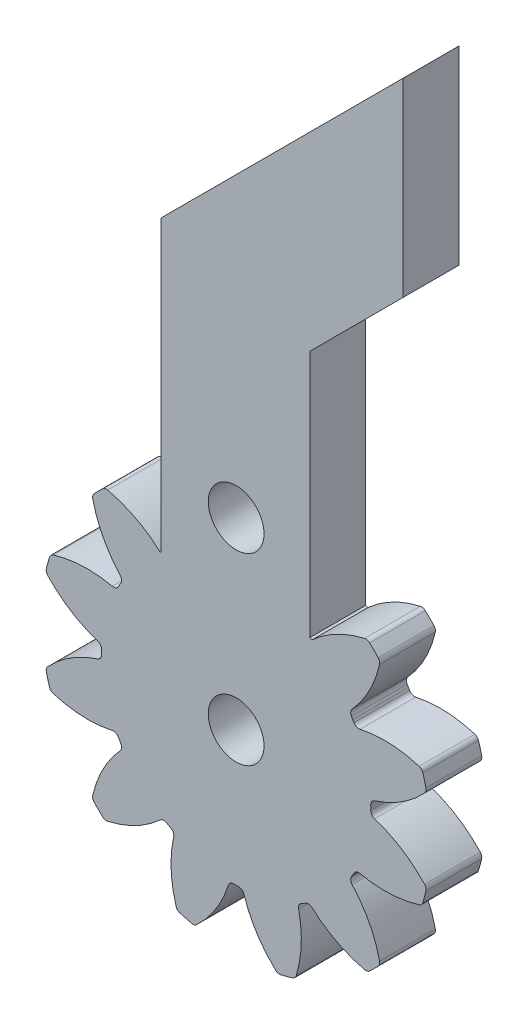
from build123d import *

# Parameters (mm, degrees)
ESQUISSE18_R        = 1.5
BOSS_EXTRU_18_DEPTH = 3


with BuildPart() as part:
    # Esquisse18 → Boss.-Extru.18 (new body)
    with BuildSketch(Plane.XY):
        with BuildLine():
            Line((83.995271076, 16.559954608), (97.025632531, 29.590316063))
            Line((97.025632531, 29.590316063), (97.025632531, 19.364814746))
            Line((97.025632531, 19.364814746), (91.995271076, 14.334453291))
            Line((91.995271076, 14.334453291), (91.995271076, 0.979857371))
            Line((91.995271076, 0.979857371), (92.123404239, 0.943388643))
            ThreePointArc((92.123404239, 0.943388643), (93.440738996, 1.864842376), (94.949542599, 2.419783395))
            ThreePointArc((94.949542599, 2.419783395), (95.094740148, 2.416733928), (95.221491727, 2.345842004))
            ThreePointArc((95.221491727, 2.345842004), (95.454932198, 2.119520802), (95.6812534, 1.886080331))
            ThreePointArc((95.6812534, 1.886080331), (95.752145324, 1.759328753), (95.755194791, 1.614131203))
            ThreePointArc((95.755194791, 1.614131203), (95.200253772, 0.1053276), (94.278800038, -1.212007157))
            ThreePointArc((94.278800038, -1.212007157), (94.201940613, -1.384508915), (94.243380312, -1.568755975))
            Line((94.243380312, -1.568755975), (94.308995173, -1.680100401))
            ThreePointArc((94.308995173, -1.680100401), (94.341055685, -1.73620681), (94.372614843, -1.792596749))
            ThreePointArc((94.372614843, -1.792596749), (94.511457628, -1.920608112), (94.699278246, -1.940296776))
            ThreePointArc((94.699278246, -1.940296776), (96.300850478, -1.800961813), (97.884983236, -2.074770594))
            ThreePointArc((97.884983236, -2.074770594), (98.009203269, -2.150010285), (98.083527395, -2.274780281))
            ThreePointArc((98.083527395, -2.274780281), (98.172532171, -2.587500427), (98.251811846, -2.902826406))
            ThreePointArc((98.251811846, -2.902826406), (98.249830264, -3.048042455), (98.179872405, -3.175311955))
            ThreePointArc((98.179872405, -3.175311955), (96.944877584, -4.204503695), (95.488207864, -4.884622193))
            ThreePointArc((95.488207864, -4.884622193), (95.33539477, -4.995583385), (95.279159072, -5.175865869))
            Line((95.279159072, -5.175865869), (95.280310995, -5.305100401))
            ThreePointArc((95.280310995, -5.305100401), (95.280023009, -5.369720233), (95.279159072, -5.434334932))
            ThreePointArc((95.279159072, -5.434334932), (95.33539477, -5.614617416), (95.488207864, -5.725578608))
            ThreePointArc((95.488207864, -5.725578608), (96.944877584, -6.405697106), (98.179872405, -7.434888846))
            ThreePointArc((98.179872405, -7.434888846), (98.249830264, -7.562158346), (98.251811846, -7.707374395))
            ThreePointArc((98.251811846, -7.707374395), (98.172532171, -8.022700374), (98.083527395, -8.33542052))
            ThreePointArc((98.083527395, -8.33542052), (98.009203269, -8.460190516), (97.884983236, -8.535430207))
            ThreePointArc((97.884983236, -8.535430207), (96.300850478, -8.809238989), (94.699278246, -8.669904025))
            ThreePointArc((94.699278246, -8.669904025), (94.511457628, -8.68959269), (94.372614843, -8.817604052))
            Line((94.372614843, -8.817604052), (94.308995173, -8.930100401))
            ThreePointArc((94.308995173, -8.930100401), (94.276435853, -8.985918824), (94.243380312, -9.041444826))
            ThreePointArc((94.243380312, -9.041444826), (94.201940613, -9.225691886), (94.278800038, -9.398193644))
            ThreePointArc((94.278800038, -9.398193644), (95.200253772, -10.715528401), (95.755194791, -12.224332004))
            ThreePointArc((95.755194791, -12.224332004), (95.752145324, -12.369529554), (95.6812534, -12.496281132))
            ThreePointArc((95.6812534, -12.496281132), (95.454932198, -12.729721603), (95.221491727, -12.956042805))
            ThreePointArc((95.221491727, -12.956042805), (95.094740148, -13.026934729), (94.949542599, -13.029984196))
            ThreePointArc((94.949542599, -13.029984196), (93.440738996, -12.475043177), (92.123404239, -11.553589444))
            ThreePointArc((92.123404239, -11.553589444), (91.950902481, -11.476730018), (91.76665542, -11.518169717))
            Line((91.76665542, -11.518169717), (91.655310995, -11.583784578))
            ThreePointArc((91.655310995, -11.583784578), (91.599204585, -11.61584509), (91.542814646, -11.647404249))
            ThreePointArc((91.542814646, -11.647404249), (91.414803284, -11.786247034), (91.39511462, -11.974067651))
            ThreePointArc((91.39511462, -11.974067651), (91.534449583, -13.575639883), (91.260640801, -15.159772642))
            ThreePointArc((91.260640801, -15.159772642), (91.185401111, -15.283992675), (91.060631115, -15.3583168))
            ThreePointArc((91.060631115, -15.3583168), (90.747910969, -15.447321577), (90.43258499, -15.526601252))
            ThreePointArc((90.43258499, -15.526601252), (90.287368941, -15.52461967), (90.160099441, -15.454661811))
            ThreePointArc((90.160099441, -15.454661811), (89.130907701, -14.219666989), (88.450789203, -12.762997269))
            ThreePointArc((88.450789203, -12.762997269), (88.339828011, -12.610184175), (88.159545526, -12.553948477))
            Line((88.159545526, -12.553948477), (88.030310995, -12.555100401))
            ThreePointArc((88.030310995, -12.555100401), (87.965691163, -12.554812414), (87.901076464, -12.553948477))
            ThreePointArc((87.901076464, -12.553948477), (87.72079398, -12.610184175), (87.609832788, -12.762997269))
            ThreePointArc((87.609832788, -12.762997269), (86.929714289, -14.219666989), (85.900522549, -15.454661811))
            ThreePointArc((85.900522549, -15.454661811), (85.77325305, -15.52461967), (85.628037, -15.526601252))
            ThreePointArc((85.628037, -15.526601252), (85.312711022, -15.447321577), (84.999990876, -15.3583168))
            ThreePointArc((84.999990876, -15.3583168), (84.875220879, -15.283992675), (84.799981189, -15.159772642))
            ThreePointArc((84.799981189, -15.159772642), (84.526172407, -13.575639883), (84.66550737, -11.974067651))
            ThreePointArc((84.66550737, -11.974067651), (84.645818706, -11.786247034), (84.517807344, -11.647404249))
            Line((84.517807344, -11.647404249), (84.405310995, -11.583784578))
            ThreePointArc((84.405310995, -11.583784578), (84.349492572, -11.551225258), (84.29396657, -11.518169717))
            ThreePointArc((84.29396657, -11.518169717), (84.10971951, -11.476730018), (83.937217751, -11.553589444))
            ThreePointArc((83.937217751, -11.553589444), (82.619882994, -12.475043177), (81.111079391, -13.029984196))
            ThreePointArc((81.111079391, -13.029984196), (80.965881842, -13.026934729), (80.839130263, -12.956042805))
            ThreePointArc((80.839130263, -12.956042805), (80.605689793, -12.729721603), (80.37936859, -12.496281132))
            ThreePointArc((80.37936859, -12.496281132), (80.308476666, -12.369529554), (80.3054272, -12.224332004))
            ThreePointArc((80.3054272, -12.224332004), (80.860368218, -10.715528401), (81.781821952, -9.398193644))
            ThreePointArc((81.781821952, -9.398193644), (81.858681377, -9.225691886), (81.817241678, -9.041444826))
            Line((81.817241678, -9.041444826), (81.751626818, -8.930100401))
            ThreePointArc((81.751626818, -8.930100401), (81.719566305, -8.873993991), (81.688007147, -8.817604052))
            ThreePointArc((81.688007147, -8.817604052), (81.549164362, -8.68959269), (81.361343744, -8.669904025))
            ThreePointArc((81.361343744, -8.669904025), (79.759771513, -8.809238989), (78.175638754, -8.535430207))
            ThreePointArc((78.175638754, -8.535430207), (78.051418721, -8.460190516), (77.977094596, -8.33542052))
            ThreePointArc((77.977094596, -8.33542052), (77.888089819, -8.022700374), (77.808810144, -7.707374395))
            ThreePointArc((77.808810144, -7.707374395), (77.810791726, -7.562158346), (77.880749585, -7.434888846))
            ThreePointArc((77.880749585, -7.434888846), (79.115744406, -6.405697106), (80.572414127, -5.725578608))
            ThreePointArc((80.572414127, -5.725578608), (80.725227221, -5.614617416), (80.781462919, -5.434334932))
            Line((80.781462919, -5.434334932), (80.780310995, -5.305100401))
            ThreePointArc((80.780310995, -5.305100401), (80.780598982, -5.240480568), (80.781462919, -5.175865869))
            ThreePointArc((80.781462919, -5.175865869), (80.725227221, -4.995583385), (80.572414127, -4.884622193))
            ThreePointArc((80.572414127, -4.884622193), (79.115744406, -4.204503695), (77.880749585, -3.175311955))
            ThreePointArc((77.880749585, -3.175311955), (77.810791726, -3.048042455), (77.808810144, -2.902826406))
            ThreePointArc((77.808810144, -2.902826406), (77.888089819, -2.587500427), (77.977094596, -2.274780281))
            ThreePointArc((77.977094596, -2.274780281), (78.051418721, -2.150010285), (78.175638754, -2.074770594))
            ThreePointArc((78.175638754, -2.074770594), (79.759771513, -1.800961813), (81.361343744, -1.940296776))
            ThreePointArc((81.361343744, -1.940296776), (81.549164362, -1.920608112), (81.688007147, -1.792596749))
            Line((81.688007147, -1.792596749), (81.751626818, -1.680100401))
            ThreePointArc((81.751626818, -1.680100401), (81.784186138, -1.624281977), (81.817241678, -1.568755975))
            ThreePointArc((81.817241678, -1.568755975), (81.858681377, -1.384508915), (81.781821952, -1.212007157))
            ThreePointArc((81.781821952, -1.212007157), (80.860368218, 0.1053276), (80.3054272, 1.614131203))
            ThreePointArc((80.3054272, 1.614131203), (80.308476666, 1.759328753), (80.37936859, 1.886080331))
            ThreePointArc((80.37936859, 1.886080331), (80.605689793, 2.119520802), (80.839130263, 2.345842004))
            ThreePointArc((80.839130263, 2.345842004), (80.965881842, 2.416733928), (81.111079391, 2.419783395))
            ThreePointArc((81.111079391, 2.419783395), (82.619882994, 1.864842376), (83.937217751, 0.943388643))
            Line((83.937217751, 0.943388643), (83.995271076, 0.970909453))
            Line((83.995271076, 0.970909453), (83.995271076, 16.559954608))
        make_face()
        with Locations((88.030310995, -5.305100401)):
            Circle(ESQUISSE18_R, mode=Mode.SUBTRACT)
        with Locations((88.030310995, 4.590763304)):
            Circle(ESQUISSE18_R, mode=Mode.SUBTRACT)
    extrude(amount=BOSS_EXTRU_18_DEPTH)


solid = part.part
